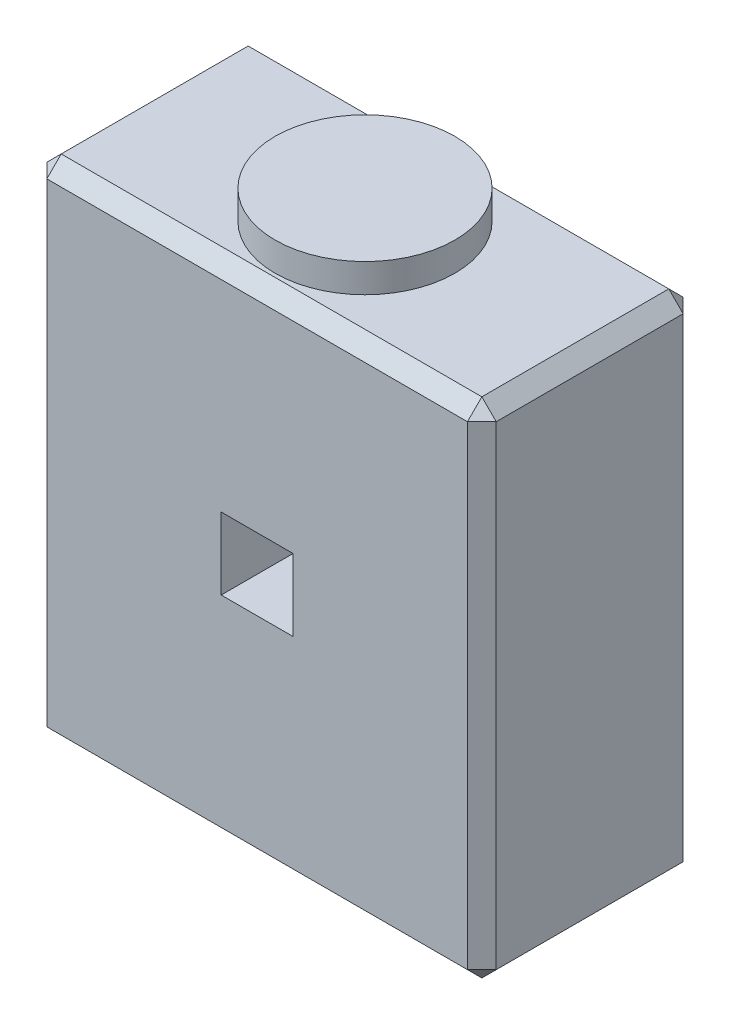
from build123d import *

# Parameters (mm, degrees)
SKETCH1_W           = 62.5
SKETCH1_H           = 70
BOSS_EXTRUDE1_DEPTH = 15
SKETCH2_R           = 12.5
BOSS_EXTRUDE2_DEPTH = 4
CHAMFER1_SIZE       = 2
SKETCH3_R           = 1
CUT_EXTRUDE1_DEPTH  = 10
SKETCH4_W           = 10
SKETCH4_H           = 10
CUT_EXTRUDE2_DEPTH  = 10
SKETCH5_W           = 9
SKETCH5_H           = 10
CUT_EXTRUDE3_DEPTH  = 10


with BuildPart() as part:
    # Sketch1 → Boss-Extrude1 (new, symmetric)
    with BuildSketch(Plane.XY):
        Rectangle(SKETCH1_W, SKETCH1_H)
    extrude(amount=BOSS_EXTRUDE1_DEPTH, both=True)

    # Sketch2 → Boss-Extrude2 (add, symmetric)
    with BuildSketch(Plane(origin=(0, 35, 0), x_dir=(1, 0, 0), z_dir=(0, 1, 0))):
        Circle(SKETCH2_R)
    extrude(amount=BOSS_EXTRUDE2_DEPTH, both=True)

    # Chamfer1
    chamfer1_edges = [part.edges().sort_by_distance(p)[0] for p in [
        (31.25, 0, 15),
        (0, 35, 15),
        (-31.25, 0, 15),
        (0, 35, -15),
        (31.25, 0, -15),
        (0, -35, -15),
        (-31.25, 0, -15),
        (-31.25, 35, 0),
        (31.25, 35, 0),
        (31.25, -35, 0),
        (-31.25, -35, 0),
        (0, -35, 15),
    ]]
    chamfer(chamfer1_edges, length=CHAMFER1_SIZE)

    # Sketch3 → Cut-Extrude1 (cut)
    with BuildSketch(Plane(origin=(0, 0, -15), x_dir=(-1, 0, 0), z_dir=(0, 0, -1))):
        with Locations((-24.25, 28)):
            Circle(SKETCH3_R)
        with Locations((24.25, 28)):
            Circle(SKETCH3_R)
        with Locations((-24.25, -28)):
            Circle(SKETCH3_R)
        with Locations((24.25, -28)):
            Circle(SKETCH3_R)
    extrude(amount=-CUT_EXTRUDE1_DEPTH, mode=Mode.SUBTRACT)

    # Sketch4 → Cut-Extrude2 (cut)
    with BuildSketch(Plane.XY.offset(15)):
        Rectangle(SKETCH4_W, SKETCH4_H)
    extrude(amount=-CUT_EXTRUDE2_DEPTH, mode=Mode.SUBTRACT)

    # Sketch5 → Cut-Extrude3 (cut)
    with BuildSketch(Plane(origin=(0, 0, -15), x_dir=(-1, 0, 0), z_dir=(0, 0, -1))):
        with Locations((5.5, 0)):
            Rectangle(SKETCH5_W, SKETCH5_H)
        with Locations((-5.5, 0)):
            Rectangle(SKETCH5_W, SKETCH5_H)
    extrude(amount=-CUT_EXTRUDE3_DEPTH, mode=Mode.SUBTRACT)


solid = part.part
